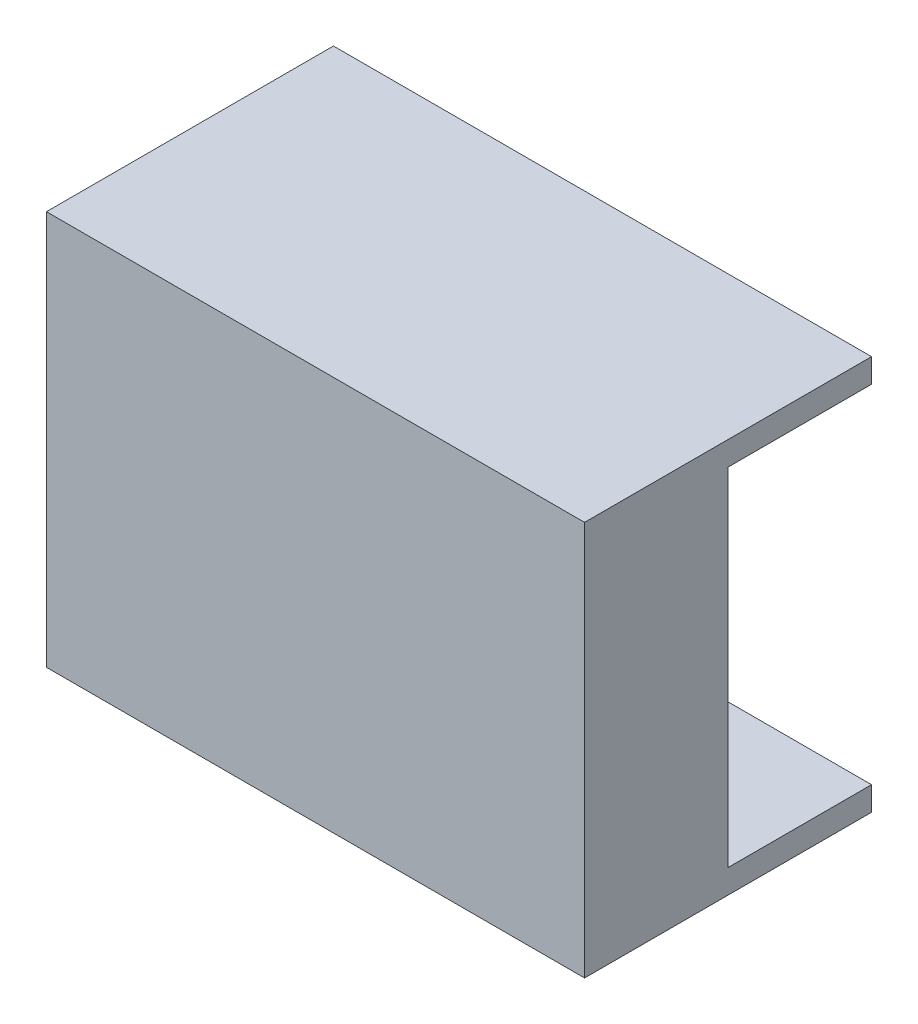
from build123d import *

# Parameters (mm, degrees)
SKETCH_1_W      = 90
SKETCH_1_H      = 4
EXTRUDE_1_DEPTH = 24
SKETCH_2_W      = 90
SKETCH_2_H      = 4
EXTRUDE_2_DEPTH = 24
SKETCH_3_W      = 90
SKETCH_3_H      = 66
EXTRUDE_3_DEPTH = 24


with BuildPart() as part:
    # 草图1 → 凸台-拉伸1 (new body)
    with BuildSketch(Plane.XY):
        with Locations((0, 31)):
            Rectangle(SKETCH_1_W, SKETCH_1_H)
    extrude(amount=EXTRUDE_1_DEPTH)



with BuildPart() as body_2:
    # 草图2 → 凸台-拉伸2 (new body)
    with BuildSketch(Plane.XY):
        with Locations((0, -31)):
            Rectangle(SKETCH_2_W, SKETCH_2_H)
    extrude(amount=EXTRUDE_2_DEPTH)


with BuildPart() as part_1:
    add(part.part)

    add(body_2.part)  # 凸台-拉伸3 merges body 2
    # 草图3 → 凸台-拉伸3 (add)
    with BuildSketch(Plane.XY.offset(24)):
        Rectangle(SKETCH_3_W, SKETCH_3_H)
    extrude(amount=EXTRUDE_3_DEPTH)


solid = part_1.part
